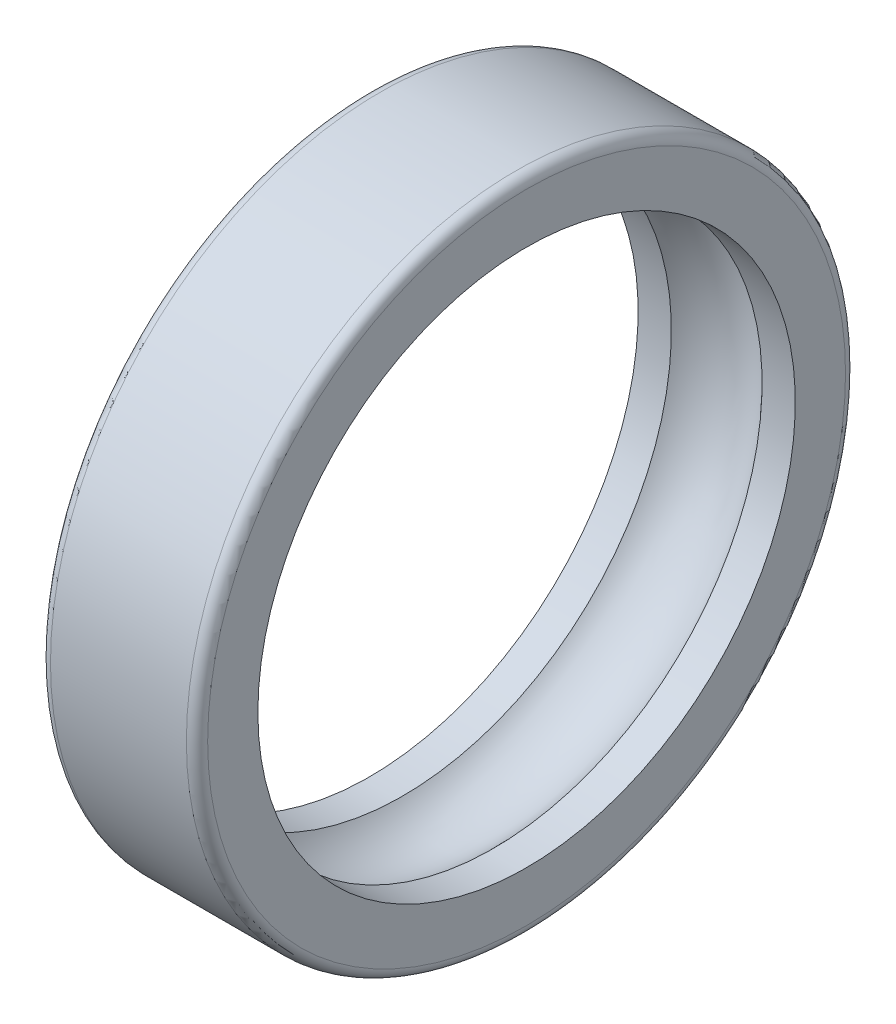
from build123d import *

# Parameters (mm, degrees)
FILLET1_R = 2.1


with BuildPart() as part:
    # Sketch1 → Revolve1 (revolve)
    with BuildSketch(Plane.XY, mode=Mode.PRIVATE) as revolve1_sk:
        with BuildLine():
            Line((15.5, 53), (8.94427191, 53))
            ThreePointArc((8.94427191, 53), (0, 57), (-8.94427191, 53))
            Line((-8.94427191, 53), (-15.5, 53))
            Line((-15.5, 53), (-15.5, 65))
            Line((-15.5, 65), (15.5, 65))
            Line((15.5, 65), (15.5, 53))
        make_face()
    revolve(revolve1_sk.sketch.rotate(Axis((-18.288359788, 0, 0), (1, 0, 0)), 90), axis=Axis((-18.288359788, 0, 0), (1, 0, 0)))

    # Fillet1
    fillet1_edges = [part.edges().sort_by_distance(p)[0] for p in [
        (15.5, 0, -65),
        (-15.5, 0, -65),
    ]]
    fillet(fillet1_edges, radius=FILLET1_R)


solid = part.part
